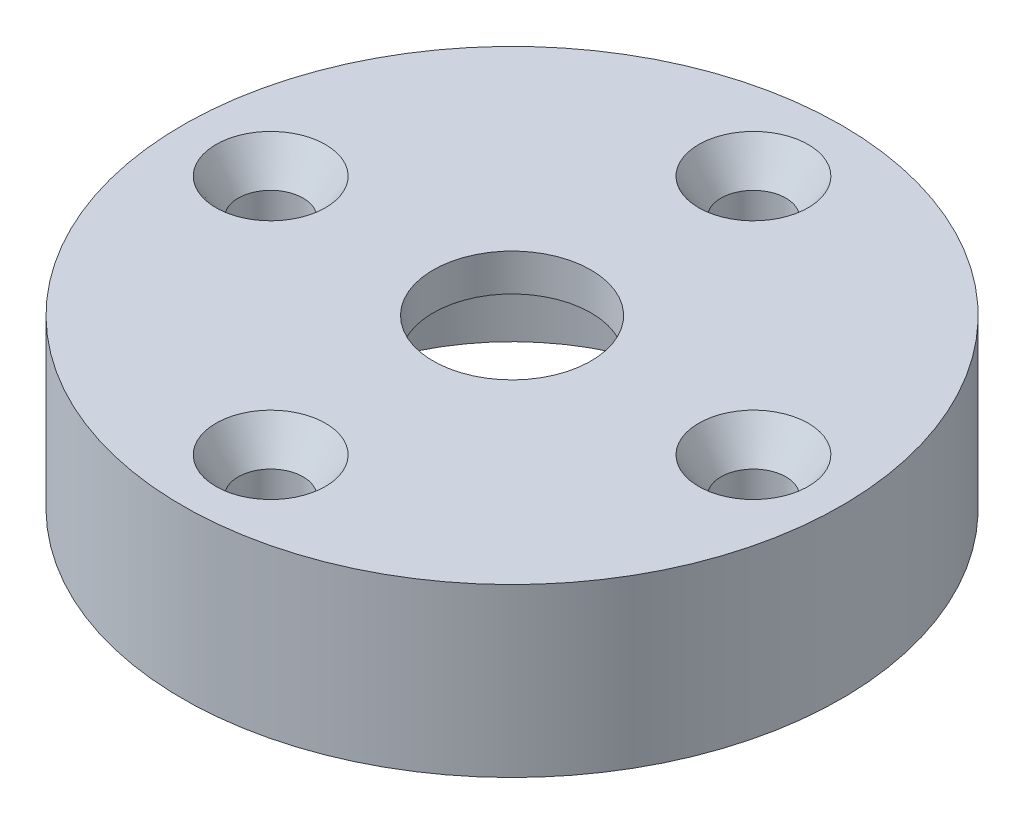
from build123d import *

# Parameters (mm, degrees)
SKETCH4_R          = 1.75
CUT_EXTRUDE1_DEPTH = 9
CHAMFER1_SIZE      = 1.2
CHAMFER1_SIZE2     = 1.9


with BuildPart() as part:
    # Sketch3 → Revolve1 (revolve)
    with BuildSketch(Plane.XY, mode=Mode.PRIVATE) as revolve1_sk:
        Polygon((-11, 0), (-17.75, 0), (-17.75, 9), (-4.25, 9), (-4.25, 7), (-11, 7), align=None)
    revolve(revolve1_sk.sketch.rotate(Axis((0, 0, 0), (0, 1, 0)), 270), axis=Axis((0, 0, 0), (0, 1, 0)))

    # Sketch4 → Cut-Extrude1 (cut)
    with BuildSketch(Plane(origin=(0, 9, 0), x_dir=(1, 0, 0), z_dir=(0, 1, 0))):
        with Locations(Location((0, 13, 0), (0, 0, 270))):
            Circle(SKETCH4_R)
        with Locations(Location((13, 0, 0), (0, 0, 270))):
            Circle(SKETCH4_R)
        with Locations(Location((0, -13, 0), (0, 0, 270))):
            Circle(SKETCH4_R)
        with Locations(Location((-13, 0, 0), (0, 0, 270))):
            Circle(SKETCH4_R)
    extrude(amount=-CUT_EXTRUDE1_DEPTH, mode=Mode.SUBTRACT)

    # Chamfer1
    chamfer1_edges = [part.edges().sort_by_distance(p)[0] for p in [
        (0, 9, -14.75),
        (13, 9, -1.75),
        (0, 9, 11.25),
        (-13, 9, -1.75),
    ]]
    chamfer1_side = [part.faces().sort_by_distance(p)[0] for p in [
        (0, 9, 17.247954185),
    ]]
    chamfer(chamfer1_edges, length=CHAMFER1_SIZE, length2=CHAMFER1_SIZE2, reference=chamfer1_side[0])


solid = part.part
